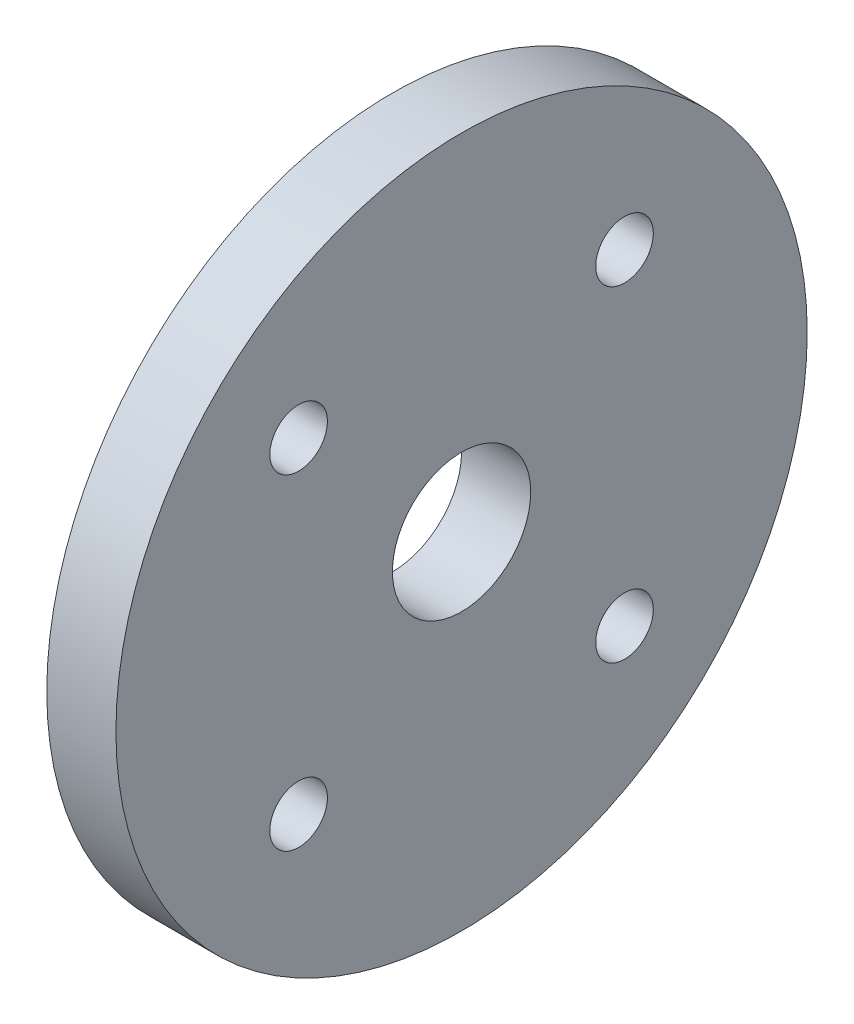
from build123d import *

# Parameters (mm, degrees)
SKETCH_1_R          = 15
EXTRUDE_1_DEPTH     = 3
M3X0_5_1_D          = 2.5
SKETCH_6_R          = 3
CUT_EXTRUDE_2_DEPTH = 22.424285286


with BuildPart() as part:
    # ｽｹｯﾁ1 → ﾎﾞｽ - 押し出し1 (new body)
    with BuildSketch(Plane(origin=(0, 0, 0), x_dir=(0, 0, -1), z_dir=(1, 0, 0))):
        Circle(SKETCH_1_R)
    extrude(amount=EXTRUDE_1_DEPTH)

    # M3x0.5 ねじ穴1 (through all)
    with Locations(Plane(origin=(3, 0, 0), x_dir=(0, 0, -1), z_dir=(1, 0, 0))):
        with Locations((-7.071067812, 7.071067812), (7.071067812, -7.071067812), (7.071067812, 7.071067812), (-7.071067812, -7.071067812)):
            Hole(M3X0_5_1_D / 2)

    # ｽｹｯﾁ6 → ｶｯﾄ - 押し出し2 (cut, through all)
    with BuildSketch(Plane(origin=(3, 0, 0), x_dir=(0, 0, -1), z_dir=(1, 0, 0))):
        Circle(SKETCH_6_R)
    extrude(amount=-CUT_EXTRUDE_2_DEPTH, mode=Mode.SUBTRACT)


solid = part.part
